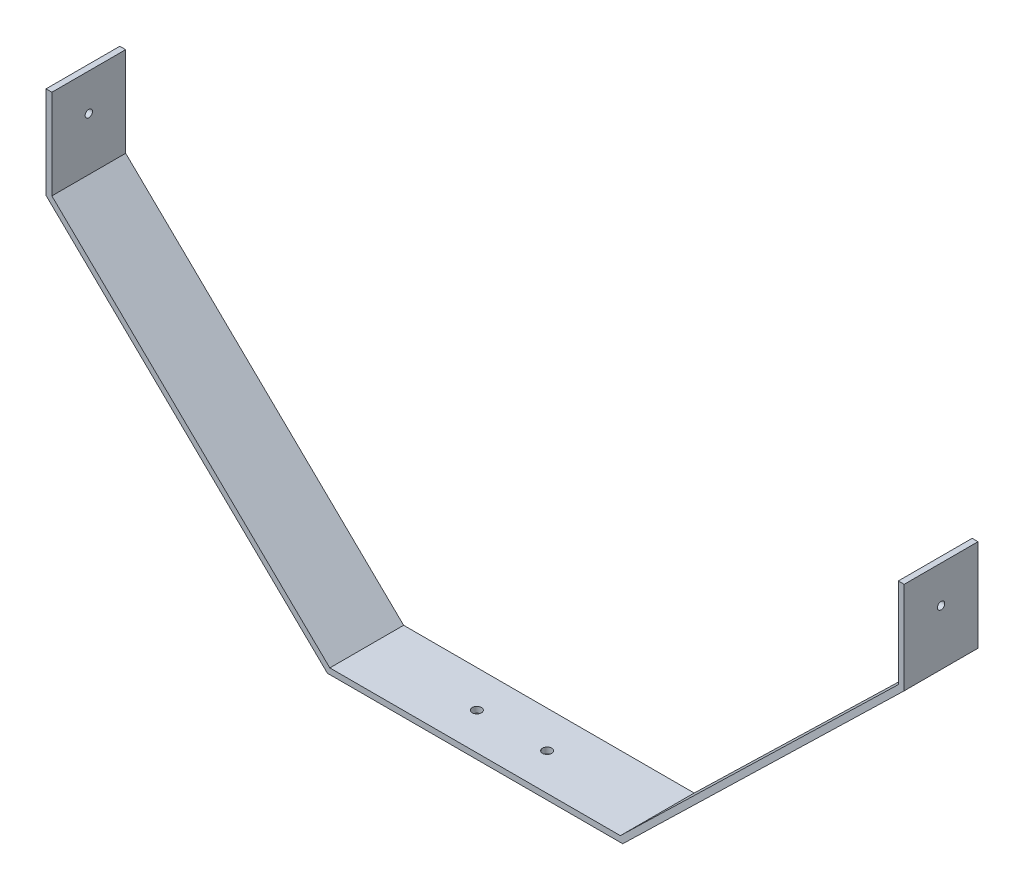
from build123d import *

# Parameters (mm, degrees)
BOSS_EXTRUDE1_DEPTH     = 40
CUT_EXTRUDE1_DEPTH      = 306.96246604
CUT_EXTRUDE1_DEPTH_BACK = 306.96246604
SKETCH3_R               = 2.5
CUT_EXTRUDE2_DEPTH      = 507.98027575
CUT_EXTRUDE2_DEPTH_BACK = 507.98027575
SKETCH4_R               = 1.984375


with BuildPart() as part:
    # Sketch1 → Boss-Extrude1 (new body)
    with BuildSketch(Plane.XY):
        Polygon((-80, 0), (80, 0), (232.5, 148), (232.5, 198), (229.325, 198), (229.325, 149.343064798), (78.712635935, 3.175), (-78.712635935, 3.175), (-229.325, 149.343064798), (-229.325, 198), (-232.5, 198), (-232.5, 148), align=None)
    extrude(amount=BOSS_EXTRUDE1_DEPTH)

    # Sketch3 → Cut-Extrude1 (cut, two sides: drawn at the far end of the back side and taken through both)
    with BuildSketch(Plane(origin=(0, 3.175, 0), x_dir=(1, 0, 0), z_dir=(0, 1, 0)).offset(-CUT_EXTRUDE1_DEPTH_BACK)):
        with Locations(Location((-19.05, -20, 0), (0, 0, 270))):
            Circle(SKETCH3_R)
        with Locations(Location((19.05, -20, 0), (0, 0, 270))):
            Circle(SKETCH3_R)
    extrude(amount=CUT_EXTRUDE1_DEPTH + CUT_EXTRUDE1_DEPTH_BACK, mode=Mode.SUBTRACT)

    # Sketch4 → Cut-Extrude2 (cut, two sides: drawn at the far end of the back side and taken through both)
    with BuildSketch(Plane.ZY.offset(232.5).offset(-CUT_EXTRUDE2_DEPTH_BACK)):
        with Locations((20, 178)):
            Circle(SKETCH4_R)
    extrude(amount=CUT_EXTRUDE2_DEPTH + CUT_EXTRUDE2_DEPTH_BACK, mode=Mode.SUBTRACT)


solid = part.part
